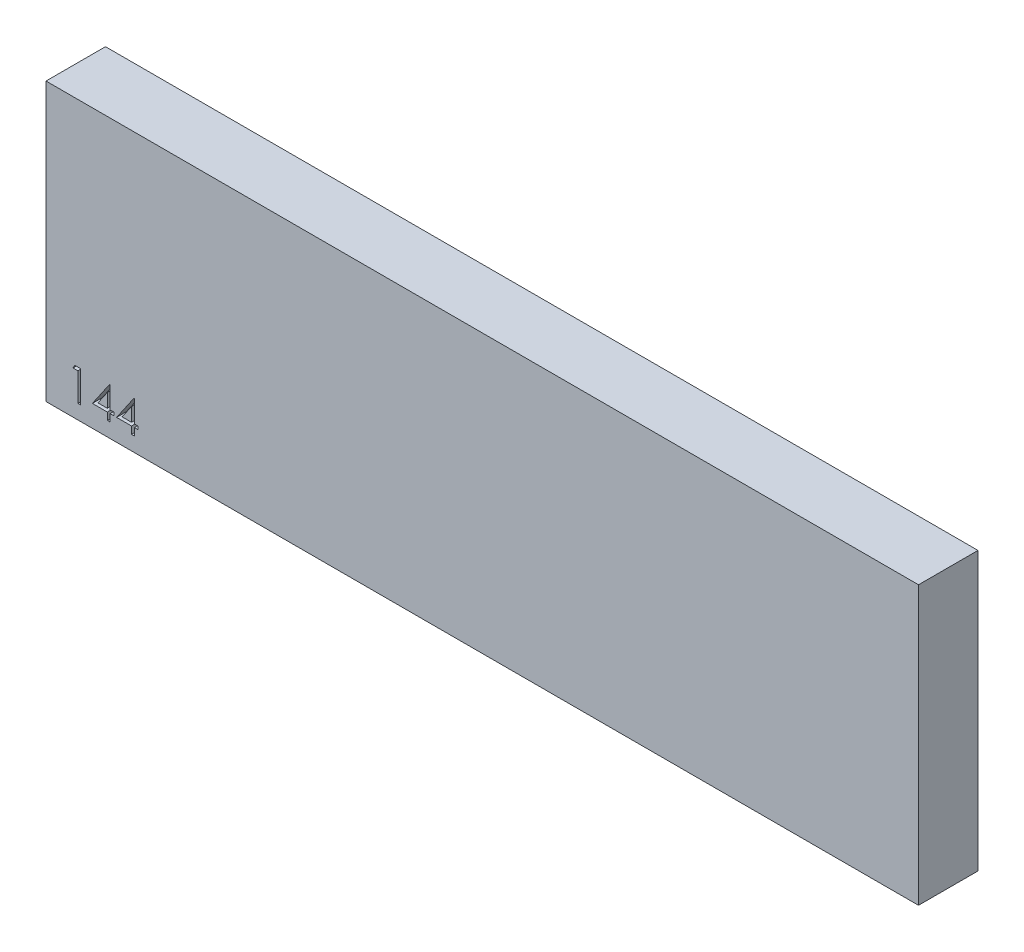
from build123d import *

# Parameters (mm, degrees)
SKETCH1_W           = 88
SKETCH1_H           = 28
BOSS_EXTRUDE1_DEPTH = 6
CUT_EXTRUDE1_DEPTH  = 1


with BuildPart() as part:
    # Sketch1 → Boss-Extrude1 (new body)
    with BuildSketch(Plane.XY):
        Rectangle(SKETCH1_W, SKETCH1_H)
    extrude(amount=BOSS_EXTRUDE1_DEPTH)

    # Sketch2 → Cut-Extrude1 (cut)
    # profile 1 of 3: a face of its own
    with BuildSketch(Plane.XY.offset(6)):
        Polygon((-41.090662112, -9.37785215), (-40.503617841, -9.37785215), (-40.503617841, -12.55285215), (-40.788553739, -12.55285215), (-40.788553739, -9.703493175), (-41.277015277, -9.703493175), align=None)
    # profile 2 of 3: a face of its own
    with BuildSketch(Plane.XY.offset(6)):
        Polygon((-37.590021086, -9.296441893), (-37.532143482, -9.296441893), (-37.532143482, -11.494518816), (-37.165797328, -11.494518816), (-37.165797328, -11.820159842), (-37.532143482, -11.820159842), (-37.532143482, -12.55285215), (-37.81707938, -12.55285215), (-37.81707938, -11.820159842), (-39.323169123, -11.820159842), align=None)
        Polygon((-37.81707938, -11.494518816), (-37.81707938, -10.115632598), (-38.76347361, -11.494518816), align=None, mode=Mode.SUBTRACT)
    # profile 3 of 3: a face of its own
    with BuildSketch(Plane.XY.offset(6)):
        Polygon((-35.147713394, -9.296441893), (-35.08983579, -9.296441893), (-35.08983579, -11.494518816), (-34.723489636, -11.494518816), (-34.723489636, -11.820159842), (-35.08983579, -11.820159842), (-35.08983579, -12.55285215), (-35.374771687, -12.55285215), (-35.374771687, -11.820159842), (-36.880861431, -11.820159842), align=None)
        Polygon((-35.374771687, -11.494518816), (-35.374771687, -10.115632598), (-36.321165918, -11.494518816), align=None, mode=Mode.SUBTRACT)
    extrude(amount=-CUT_EXTRUDE1_DEPTH, mode=Mode.SUBTRACT)


solid = part.part
